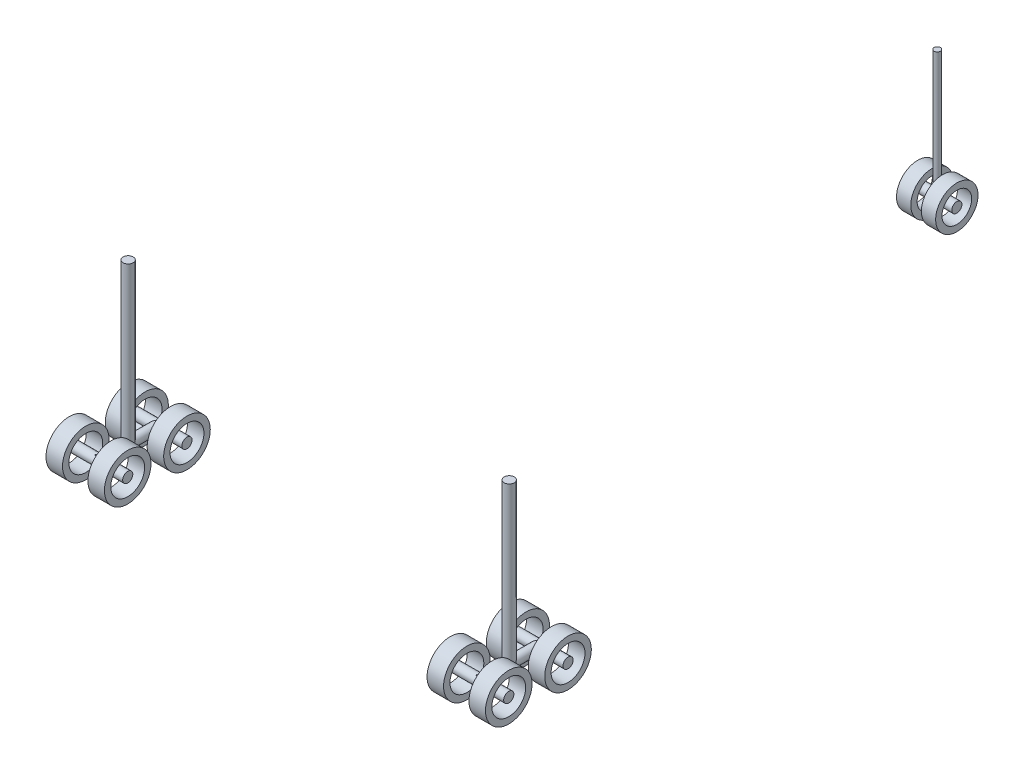
from build123d import *

# Parameters (mm, degrees)
SKETCH16_R               = 558.8000005080007
SKETCH16_R_2             = 406.3999999999997
BOSS_EXTRUDE1_DEPTH      = 396.24
BOSS_EXTRUDE1_2_DEPTH    = 396.24
SKETCH12_R               = 121.92000000000041
BOSS_EXTRUDE2_DEPTH      = 3810.0000000000005
SKETCH17_R               = 121.92000000000046
BOSS_EXTRUDE3_DEPTH      = 1402.08
SKETCH17_R_2             = 121.92000000000138
BOSS_EXTRUDE3_2_DEPTH    = 1402.08
BOSS_EXTRUDE4_DEPTH      = 762.0000000000001
BOSS_EXTRUDE4_DEPTH_BACK = 762.0000000000001
SKETCH18_R               = 121.92000000000046
SKETCH19_R               = 507.9999999999988
SKETCH19_R_2             = 355.60000000000025
BOSS_EXTRUDE5_DEPTH      = 342.9
SKETCH20_R               = 121.92000000000138
BOSS_EXTRUDE6_DEPTH      = 939.8
SKETCH21_R               = 76.20000000000083
BOSS_EXTRUDE7_DEPTH      = 3048.0000000000005


with BuildPart() as part:
    # Sketch16 → Boss-Extrude1 (new body)
    with BuildSketch(Plane(origin=(-4876.8, 0, 0), x_dir=(0, 0, -1), z_dir=(1, 0, 0))):
        with Locations((-3177.3757869238866, -1.866e-14)):
            Circle(SKETCH16_R)
        with Locations((-3177.3757869238866, -1.866e-14)):
            Circle(SKETCH16_R_2, mode=Mode.SUBTRACT)
    extrude(amount=-BOSS_EXTRUDE1_DEPTH)


with BuildPart() as body_2:
    # Sketch16 → Boss-Extrude1 2 (new body)
    with BuildSketch(Plane(origin=(-4876.8, 0, 0), x_dir=(0, 0, -1), z_dir=(1, 0, 0))):
        with Locations(Location((-4599.775787939885, -1.866e-14, 0), (0, 0, 180))):
            Circle(SKETCH16_R)
        with Locations(Location((-4599.775787939885, -1.866e-14, 0), (0, 0, 180))):
            Circle(SKETCH16_R_2, mode=Mode.SUBTRACT)
    extrude(amount=-BOSS_EXTRUDE1_2_DEPTH)


with BuildPart() as body_3:
    # Mirror2: mirrored copy
    add(part.part.mirror(Plane(origin=(-4572, 0, 0), x_dir=(0, 0, 1), z_dir=(1, 0, 0))))


with BuildPart() as body_4:
    # Mirror2 2: mirrored copy
    add(body_2.part.mirror(Plane(origin=(-4572, 0, 0), x_dir=(0, 0, 1), z_dir=(1, 0, 0))))


with BuildPart() as body_5:
    # Sketch12 → Boss-Extrude2 (new body)
    with BuildSketch(Plane(origin=(0, 0, 0), x_dir=(1, 0, 0), z_dir=(0, 1, 0))):
        with Locations(Location((-4572, -3888.5757874318856, 0), (0, 0, 90))):
            Circle(SKETCH12_R)
    extrude(amount=BOSS_EXTRUDE2_DEPTH)



with BuildPart() as body_6:
    # Sketch17 → Boss-Extrude3 (new body)
    with BuildSketch(Plane.ZY.offset(5273.04)):
        with Locations((3177.3757869238866, -1.866e-14)):
            Circle(SKETCH17_R)
    extrude(amount=-BOSS_EXTRUDE3_DEPTH)


with BuildPart() as body_7:
    # Sketch17 → Boss-Extrude3 2 (new body)
    with BuildSketch(Plane.ZY.offset(5273.04)):
        with Locations((4599.775787939885, -1.866e-14)):
            Circle(SKETCH17_R_2)
    extrude(amount=-BOSS_EXTRUDE3_2_DEPTH)


with BuildPart() as body_5_1:
    add(body_5.part)

    add(body_6.part)  # Boss-Extrude4 merges body 6

    add(body_7.part)  # Boss-Extrude4 merges body 7
    # Sketch18 → Boss-Extrude4 (add, two sides: drawn at the far end of the back side and taken through both)
    with BuildSketch(Plane.XY.offset(3888.5757874318865).offset(-BOSS_EXTRUDE4_DEPTH_BACK)):
        with Locations(Location((-4572, 0, 0), (0, 0, 90))):
            Circle(SKETCH18_R)
    extrude(amount=BOSS_EXTRUDE4_DEPTH + BOSS_EXTRUDE4_DEPTH_BACK)


with BuildPart() as body_6_2:
    # Sketch19 → Boss-Extrude5 (new body)
    with BuildSketch(Plane(origin=(-126.99999999999945, 0, 0), x_dir=(0, 0, -1), z_dir=(1, 0, 0))):
        with Locations((10955.184212568114, -2.141e-14)):
            Circle(SKETCH19_R)
        with Locations((10955.184212568114, -2.141e-14)):
            Circle(SKETCH19_R_2, mode=Mode.SUBTRACT)
    extrude(amount=-BOSS_EXTRUDE5_DEPTH)


with BuildPart() as body_7_2:
    # Mirror4: mirrored copy
    add(body_6_2.part.mirror(Plane(origin=(0, 0, 0), x_dir=(0, 0, 1), z_dir=(1, 0, 0))))


with BuildPart() as body_8:
    # Mirror4 2: mirrored copy
    add(body_2.part.mirror(Plane(origin=(0, 0, 0), x_dir=(0, 0, 1), z_dir=(1, 0, 0))))


with BuildPart() as body_9:
    # Mirror4 3: mirrored copy
    add(part.part.mirror(Plane(origin=(0, 0, 0), x_dir=(0, 0, 1), z_dir=(1, 0, 0))))


with BuildPart() as body_10:
    # Mirror4 4: mirrored copy
    add(body_4.part.mirror(Plane(origin=(0, 0, 0), x_dir=(0, 0, 1), z_dir=(1, 0, 0))))


with BuildPart() as body_11:
    # Mirror4 5: mirrored copy
    add(body_5_1.part.mirror(Plane(origin=(0, 0, 0), x_dir=(0, 0, 1), z_dir=(1, 0, 0))))


with BuildPart() as body_12:
    # Mirror4 6: mirrored copy
    add(body_3.part.mirror(Plane(origin=(0, 0, 0), x_dir=(0, 0, 1), z_dir=(1, 0, 0))))


with BuildPart() as body_13:
    # Sketch20 → Boss-Extrude6 (new body)
    with BuildSketch(Plane.ZY.offset(469.8999999999994)):
        with Locations((-10955.184212568114, -2.141e-14)):
            Circle(SKETCH20_R)
    extrude(amount=-BOSS_EXTRUDE6_DEPTH)

    # Sketch21 → Boss-Extrude7 (add)
    with BuildSketch(Plane(origin=(0, 0, 0), x_dir=(1, 0, 0), z_dir=(0, 1, 0))):
        with Locations(Location((7.3161e-13, 10955.184212568114, 0), (0, 0, 90))):
            Circle(SKETCH21_R)
    extrude(amount=BOSS_EXTRUDE7_DEPTH)


solid = Compound([part.part, body_2.part, body_3.part, body_4.part, body_5_1.part, body_6_2.part, body_7_2.part, body_8.part, body_9.part, body_10.part, body_11.part, body_12.part, body_13.part])
